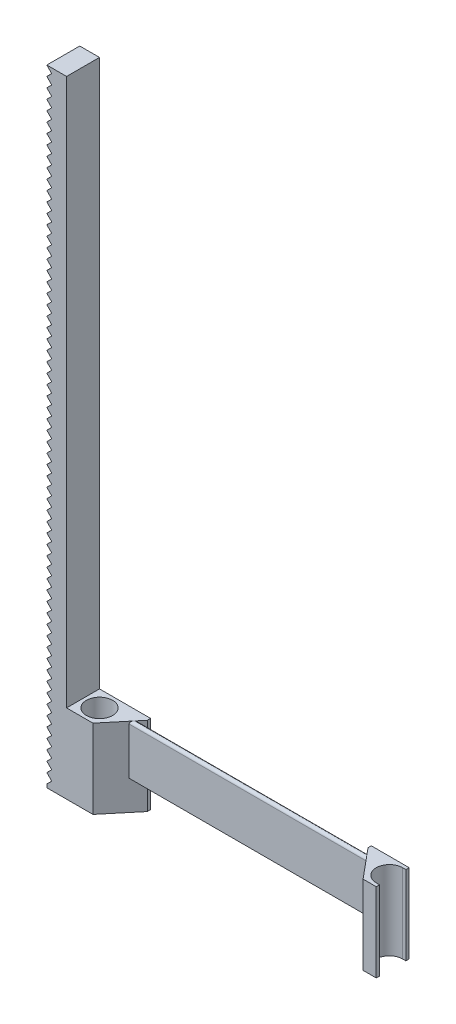
from build123d import *

# Parameters (mm, degrees)
ESQUISSE1_W                = 45
ESQUISSE1_H                = 15
BOSS_EXTRU_1_DEPTH         = 0.5
BOSS_EXTRU_2_DEPTH         = 15
ESQUISSE3_W                = 33.5
ESQUISSE3_H                = 7.5
ENL_V_MAT_EXTRU_1_DEPTH    = 48.647140523
BOSS_EXTRU_5_DEPTH         = 20
BOSS_EXTRU_5_DEPTH_BACK    = 20
ESQUISSE10_W               = 64.680470467
ESQUISSE10_H               = 24.042247858
ENL_V_MAT_EXTRU_3_DEPTH    = 3
ESQUISSE11_W               = 33.5
ESQUISSE11_H               = 0.5
ENL_V_MAT_EXTRU_4_DEPTH    = 47.840153715
ESQUISSE12_W               = 10.593660794
ESQUISSE12_H               = 24.624800323
ENL_V_MAT_EXTRU_5_DEPTH    = 0.5
BOSS_EXTRU_6_DEPTH         = 12
BOSS_EXTRU_7_DEPTH         = 83
BOSS_EXTRU_7_DEPTH_BACK    = 12
ESQUISSE13_3_W             = 3
ESQUISSE13_3_H             = 5
ENL_V_MAT_EXTRU_6_DEPTH    = 185
R_P_TITION_LIN_AIRE2_COUNT = 63
R_P_TITION_LIN_AIRE2_PITCH = 1.5
ESQUISSE8_W                = 33.5
ESQUISSE8_H                = 3
ENL_V_MAT_EXTRU_2_DEPTH    = 0.5


with BuildPart() as part:
    # Esquisse1 → Boss.-Extru.1 (new body)
    with BuildSketch(Plane.XY):
        with Locations((22.5, 7.5)):
            Rectangle(ESQUISSE1_W, ESQUISSE1_H)
    extrude(amount=BOSS_EXTRU_1_DEPTH)

    # Esquisse2 → Boss.-Extru.2 (add)
    with BuildSketch(Plane(origin=(0, 15, 0), x_dir=(1, 0, 0), z_dir=(0, 1, 0))):
        with BuildLine():
            ThreePointArc((0.5, -0.5), (2.5, -2.5), (0.5, -4.5))
            Line((0.5, -4.5), (0, -4.5))
            Line((0, -4.5), (0, -5))
            Line((0, -5), (0.5, -5))
            Line((0.5, -5), (2, -5))
            Line((2, -5), (5.75, -0.5))
            Line((5.75, -0.5), (0.5, -0.5))
        make_face()
        with BuildLine():
            Line((44.5, -0.5), (39.25, -0.5))
            Line((39.25, -0.5), (43, -5))
            Line((43, -5), (44.5, -5))
            Line((44.5, -5), (45, -5))
            Line((45, -5), (45, -4.5))
            Line((45, -4.5), (44.5, -4.5))
            ThreePointArc((44.5, -4.5), (42.5, -2.5), (44.5, -0.5))
        make_face()
    extrude(amount=-BOSS_EXTRU_2_DEPTH)

    # Esquisse3 → Enlèv. mat.-Extru.1 (cut, through all)
    with BuildSketch(Plane.XY.offset(0.5)):
        with Locations((22.5, 3.75)):
            Rectangle(ESQUISSE3_W, ESQUISSE3_H)
    extrude(amount=-ENL_V_MAT_EXTRU_1_DEPTH, mode=Mode.SUBTRACT)

    # Esquisse7 → Boss.-Extru.5 (add, two sides: drawn at the far end of the back side and taken through both)
    with BuildSketch(Plane.ZY.offset(-22.5).offset(-BOSS_EXTRU_5_DEPTH_BACK)):
        with BuildLine():
            Line((1, 7.5), (2, 7.5))
            Line((2, 7.5), (2, 14.625))
            ThreePointArc((2, 14.625), (1.625, 15), (1.25, 14.625))
            Line((1.25, 14.625), (1, 7.5))
        make_face()
    extrude(amount=BOSS_EXTRU_5_DEPTH + BOSS_EXTRU_5_DEPTH_BACK)

    # Esquisse10 → Enlèv. mat.-Extru.3 (cut)
    with BuildSketch(Plane.XZ):
        with Locations((25.714759003, 2.202104928)):
            Rectangle(ESQUISSE10_W, ESQUISSE10_H)
    extrude(amount=-ENL_V_MAT_EXTRU_3_DEPTH, mode=Mode.SUBTRACT)

    # Esquisse11 → Enlèv. mat.-Extru.4 (cut, through all)
    with BuildSketch(Plane(origin=(0, 15, 0), x_dir=(1, 0, 0), z_dir=(0, 1, 0))):
        with Locations((22.5, -0.25)):
            Rectangle(ESQUISSE11_W, ESQUISSE11_H)
    extrude(amount=-ENL_V_MAT_EXTRU_4_DEPTH, mode=Mode.SUBTRACT)

    # Esquisse12 → Enlèv. mat.-Extru.5 (cut)
    with BuildSketch(Plane.ZY):
        with Locations((2.946764515, 5.852855815)):
            Rectangle(ESQUISSE12_W, ESQUISSE12_H)
    extrude(amount=-ENL_V_MAT_EXTRU_5_DEPTH, mode=Mode.SUBTRACT)

    # Esquisse13 → Boss.-Extru.6 (add)
    with BuildSketch(Plane(origin=(0, 15, 0), x_dir=(1, 0, 0), z_dir=(0, 1, 0))):
        with BuildLine():
            Line((-2, -5), (0.5, -5))
            Line((0.5, -5), (0.5, -4.5))
            ThreePointArc((0.5, -4.5), (-1.5, -2.5), (0.5, -0.5))
            Line((0.5, -0.5), (0.5, 0))
            Line((0.5, 0), (-2, 0))
            Line((-2, 0), (-2, -5))
        make_face()
    extrude(amount=-BOSS_EXTRU_6_DEPTH)

    # Esquisse13<3> → Boss.-Extru.7 (add, two sides: drawn at the far end of the back side and taken through both)
    with BuildSketch(Plane(origin=(0, 15, 0), x_dir=(1, 0, 0), z_dir=(0, 1, 0)).offset(-BOSS_EXTRU_7_DEPTH_BACK)):
        with Locations((-3.5, -2.5)):
            Rectangle(ESQUISSE13_3_W, ESQUISSE13_3_H)
    extrude(amount=BOSS_EXTRU_7_DEPTH + BOSS_EXTRU_7_DEPTH_BACK)

    # Esquisse14 → Enlèv. mat.-Extru.6 (cut)
    with BuildSketch(Plane(origin=(0, 0, 0), x_dir=(-1, 0, 0), z_dir=(0, 0, -1))):
        Polygon((5, 98), (4.250024873, 97.243891844), (5, 96.5), align=None)
    enl_v_mat_extru_6 = extrude(amount=-ENL_V_MAT_EXTRU_6_DEPTH, mode=Mode.SUBTRACT)

    # Répétition linéaire2: Enlèv. mat.-Extru.6 ×63
    with Locations(*[(0, -i * R_P_TITION_LIN_AIRE2_PITCH, 0) for i in range(1, R_P_TITION_LIN_AIRE2_COUNT)]):
        add(enl_v_mat_extru_6, mode=Mode.SUBTRACT)

    # Esquisse8 → Enlèv. mat.-Extru.2 (cut)
    with BuildSketch(Plane(origin=(0, 0, 0), x_dir=(-1, 0, 0), z_dir=(0, 0, -1))):
        with Locations((-22.5, 9)):
            Rectangle(ESQUISSE8_W, ESQUISSE8_H)
    extrude(amount=-ENL_V_MAT_EXTRU_2_DEPTH, mode=Mode.SUBTRACT)


solid = part.part
